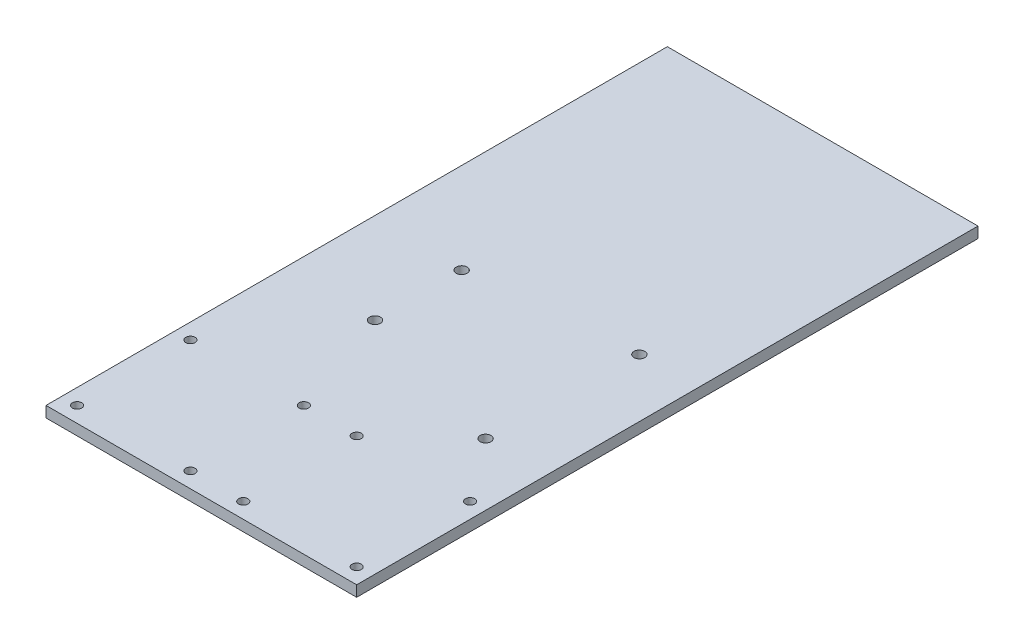
from build123d import *

# Parameters (mm, degrees)
SKETCH1_W           = 100
SKETCH1_H           = 200
BOSS_EXTRUDE1_DEPTH = 3.5
CUT_EXTRUDE9_REACH  = 113.858
SKETCH4_R           = 1.75
CUT_EXTRUDE10_REACH = 113.858
SKETCH2_R           = 1.5


with BuildPart() as part:
    # Sketch1 → Boss-Extrude1 (new body)
    with BuildSketch(Plane(origin=(0, 0, 0), x_dir=(1, 0, 0), z_dir=(0, 1, 0))):
        Rectangle(SKETCH1_W, SKETCH1_H)
    extrude(amount=BOSS_EXTRUDE1_DEPTH)

    # Sketch4 → Cut-Extrude9 (cut, up to next)
    with BuildSketch(Plane(origin=(0, 3.5, 0), x_dir=(1, 0, 0), z_dir=(0, 1, 0)), mode=Mode.PRIVATE) as cut_extrude9_sk1:
        with Locations(Location((30, -38.5, 0), (0, 0, 270))):
            Circle(SKETCH4_R)
    cut_extrude9_tool1 = extrude(cut_extrude9_sk1.sketch, amount=-CUT_EXTRUDE9_REACH, mode=Mode.PRIVATE) & part.part
    # Sketch4 → Cut-Extrude9 (cut, up to next)
    with BuildSketch(Plane(origin=(0, 3.5, 0), x_dir=(1, 0, 0), z_dir=(0, 1, 0)), mode=Mode.PRIVATE) as cut_extrude9_sk2:
        with Locations(Location((-20.8, -23.3, 0), (0, 0, 270))):
            Circle(SKETCH4_R)
    cut_extrude9_tool2 = extrude(cut_extrude9_sk2.sketch, amount=-CUT_EXTRUDE9_REACH, mode=Mode.PRIVATE) & part.part
    # Sketch4 → Cut-Extrude9 (cut, up to next)
    with BuildSketch(Plane(origin=(0, 3.5, 0), x_dir=(1, 0, 0), z_dir=(0, 1, 0)), mode=Mode.PRIVATE) as cut_extrude9_sk3:
        with Locations(Location((-20.8, 4.6, 0), (0, 0, 270))):
            Circle(SKETCH4_R)
    cut_extrude9_tool3 = extrude(cut_extrude9_sk3.sketch, amount=-CUT_EXTRUDE9_REACH, mode=Mode.PRIVATE) & part.part
    # Sketch4 → Cut-Extrude9 (cut, up to next)
    with BuildSketch(Plane(origin=(0, 3.5, 0), x_dir=(1, 0, 0), z_dir=(0, 1, 0)), mode=Mode.PRIVATE) as cut_extrude9_sk4:
        with Locations(Location((31.3, 9.7, 0), (0, 0, 270))):
            Circle(SKETCH4_R)
    cut_extrude9_tool4 = extrude(cut_extrude9_sk4.sketch, amount=-CUT_EXTRUDE9_REACH, mode=Mode.PRIVATE) & part.part
    add(cut_extrude9_tool1.solids().sort_by_distance((30, 3.5, 38.5))[0], mode=Mode.SUBTRACT)
    add(cut_extrude9_tool2.solids().sort_by_distance((-20.8, 3.5, 23.3))[0], mode=Mode.SUBTRACT)
    add(cut_extrude9_tool3.solids().sort_by_distance((-20.8, 3.5, -4.6))[0], mode=Mode.SUBTRACT)
    add(cut_extrude9_tool4.solids().sort_by_distance((31.3, 3.5, -9.7))[0], mode=Mode.SUBTRACT)

    # Sketch2 → Cut-Extrude10 (cut, up to next)
    with BuildSketch(Plane(origin=(0, 3.5, 0), x_dir=(1, 0, 0), z_dir=(0, 1, 0)), mode=Mode.PRIVATE) as cut_extrude10_sk1:
        with Locations(Location((-45, -58.5, 0), (0, 0, 270))):
            Circle(SKETCH2_R)
    cut_extrude10_tool1 = extrude(cut_extrude10_sk1.sketch, amount=-CUT_EXTRUDE10_REACH, mode=Mode.PRIVATE) & part.part
    # Sketch2 → Cut-Extrude10 (cut, up to next)
    with BuildSketch(Plane(origin=(0, 3.5, 0), x_dir=(1, 0, 0), z_dir=(0, 1, 0)), mode=Mode.PRIVATE) as cut_extrude10_sk2:
        with Locations(Location((-45, -95, 0), (0, 0, 270))):
            Circle(SKETCH2_R)
    cut_extrude10_tool2 = extrude(cut_extrude10_sk2.sketch, amount=-CUT_EXTRUDE10_REACH, mode=Mode.PRIVATE) & part.part
    # Sketch2 → Cut-Extrude10 (cut, up to next)
    with BuildSketch(Plane(origin=(0, 3.5, 0), x_dir=(1, 0, 0), z_dir=(0, 1, 0)), mode=Mode.PRIVATE) as cut_extrude10_sk3:
        with Locations(Location((-8.5, -58.5, 0), (0, 0, 270))):
            Circle(SKETCH2_R)
    cut_extrude10_tool3 = extrude(cut_extrude10_sk3.sketch, amount=-CUT_EXTRUDE10_REACH, mode=Mode.PRIVATE) & part.part
    # Sketch2 → Cut-Extrude10 (cut, up to next)
    with BuildSketch(Plane(origin=(0, 3.5, 0), x_dir=(1, 0, 0), z_dir=(0, 1, 0)), mode=Mode.PRIVATE) as cut_extrude10_sk4:
        with Locations(Location((-8.5, -95, 0), (0, 0, 270))):
            Circle(SKETCH2_R)
    cut_extrude10_tool4 = extrude(cut_extrude10_sk4.sketch, amount=-CUT_EXTRUDE10_REACH, mode=Mode.PRIVATE) & part.part
    cut_extrude10_1 = cut_extrude10_tool1.solids().sort_by_distance((-45, 3.5, 58.5))[0]
    add(cut_extrude10_1, mode=Mode.SUBTRACT)
    cut_extrude10_2 = cut_extrude10_tool2.solids().sort_by_distance((-45, 3.5, 95))[0]
    add(cut_extrude10_2, mode=Mode.SUBTRACT)
    cut_extrude10_3 = cut_extrude10_tool3.solids().sort_by_distance((-8.5, 3.5, 58.5))[0]
    add(cut_extrude10_3, mode=Mode.SUBTRACT)
    cut_extrude10_4 = cut_extrude10_tool4.solids().sort_by_distance((-8.5, 3.5, 95))[0]
    add(cut_extrude10_4, mode=Mode.SUBTRACT)
    cut_extrude10 = cut_extrude10_1 + cut_extrude10_2 + cut_extrude10_3 + cut_extrude10_4  # Cut-Extrude10 as one shape, for the pattern or mirror that repeats it

    # Mirror2: Cut-Extrude10 across plane
    add(cut_extrude10.mirror(Plane(origin=(0, 0, 0), x_dir=(0, 0, 1), z_dir=(1, 0, 0))), mode=Mode.SUBTRACT)


solid = part.part
